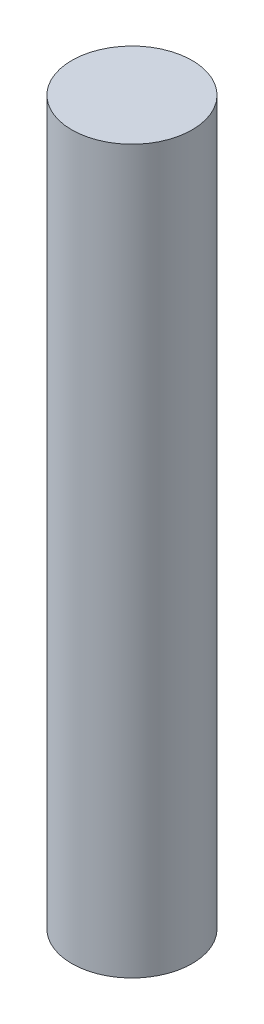
from build123d import *

# Parameters (mm, degrees)
SKETCH1_R           = 2.38125
BOSS_EXTRUDE1_DEPTH = 28.575


with BuildPart() as part:
    # Sketch1 → Boss-Extrude1 (new body)
    with BuildSketch(Plane(origin=(0, 0, 0), x_dir=(1, 0, 0), z_dir=(0, 1, 0))):
        with Locations(Location((0, 0, 0), (0, 0, 270))):
            Circle(SKETCH1_R)
    extrude(amount=BOSS_EXTRUDE1_DEPTH)


solid = part.part
